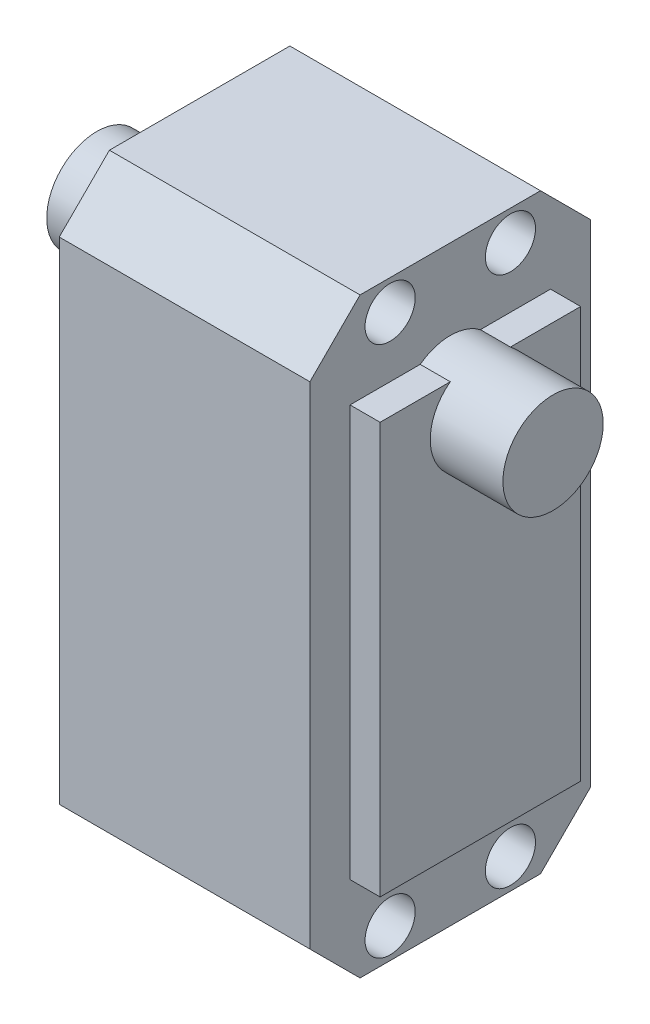
from build123d import *

# Parameters (mm, degrees)
SKETCH1_W           = 2.5
SKETCH1_H           = 6.3
BOSS_EXTRUDE2_DEPTH = 2.8
SKETCH3_W           = 2
SKETCH3_H           = 4.1
BOSS_EXTRUDE3_DEPTH = 0.3
SKETCH4_W           = 2
SKETCH4_H           = 4.1
BOSS_EXTRUDE4_DEPTH = 0.3
SKETCH5_R           = 0.25
CUT_EXTRUDE1_DEPTH  = 10.3
FILLET1_R           = 0.2
SKETCH6_R           = 0.5
BOSS_EXTRUDE5_DEPTH = 2.275
CUT_EXTRUDE2_DEPTH  = 10
CUT_EXTRUDE3_DEPTH  = 10


with BuildPart() as part:
    # Sketch1 → Boss-Extrude2 (new body)
    with BuildSketch(Plane.XY):
        with Locations((1.25, 3.15)):
            Rectangle(SKETCH1_W, SKETCH1_H)
    extrude(amount=BOSS_EXTRUDE2_DEPTH)

    # Sketch3 → Boss-Extrude3 (add)
    with BuildSketch(Plane(origin=(2.5, 0, 0), x_dir=(0, 0, -1), z_dir=(1, 0, 0))):
        with Locations((-1.4, 3.15)):
            Rectangle(SKETCH3_W, SKETCH3_H)
    extrude(amount=BOSS_EXTRUDE3_DEPTH)

    # Sketch4 → Boss-Extrude4 (add)
    with BuildSketch(Plane.ZY):
        with Locations((1.4, 3.15)):
            Rectangle(SKETCH4_W, SKETCH4_H)
    extrude(amount=BOSS_EXTRUDE4_DEPTH)

    # Sketch5 → Cut-Extrude1 (cut)
    with BuildSketch(Plane.ZY):
        with Locations((0.8, 0.5)):
            Circle(SKETCH5_R)
        with Locations((2, 0.5)):
            Circle(SKETCH5_R)
        with Locations((0.8, 5.8)):
            Circle(SKETCH5_R)
        with Locations((2, 5.8)):
            Circle(SKETCH5_R)
    extrude(amount=-CUT_EXTRUDE1_DEPTH, mode=Mode.SUBTRACT)

    # Fillet1
    fillet1_edges = [part.edges().sort_by_distance(p)[0] for p in [
        (1.25, 6.3, 2.8),
        (1.25, 6.3, 0),
        (1.25, 0, 0),
        (1.25, 0, 2.8),
    ]]
    fillet(fillet1_edges, radius=FILLET1_R)

    # Sketch6 → Boss-Extrude5 (add, symmetric)
    with BuildSketch(Plane(origin=(1.25, 0, 0), x_dir=(0, 0, -1), z_dir=(1, 0, 0))):
        with Locations(Location((-1.4, 4.8, 0), (0, 0, 126.869897646))):
            Circle(SKETCH6_R)
    extrude(amount=BOSS_EXTRUDE5_DEPTH, both=True)

    # Sketch7 → Cut-Extrude2 (cut)
    with BuildSketch(Plane.ZY):
        Polygon((0, 6.1), (2.8, 6.1), (2.8, 6.3), (2.6, 6.3), (0.2, 6.3), (0, 6.3), align=None)
        Polygon((0, 0.2), (2.8, 0.2), (2.8, 0), (2.6, 0), (0.2, 0), (0, 0), align=None)
    extrude(amount=-CUT_EXTRUDE2_DEPTH, mode=Mode.SUBTRACT)

    # Sketch8 → Cut-Extrude3 (cut)
    with BuildSketch(Plane.ZY):
        Polygon((2.8, 6.1), (2.8, 5.6), (2.3, 6.1), align=None)
        Polygon((0, 6.1), (0.5, 6.1), (0, 5.6), align=None)
        Polygon((0, 0.2), (0, 0.7), (0.5, 0.2), align=None)
        Polygon((2.8, 0.2), (2.8, 0.7), (2.3, 0.2), align=None)
    extrude(amount=-CUT_EXTRUDE3_DEPTH, mode=Mode.SUBTRACT)


solid = part.part
